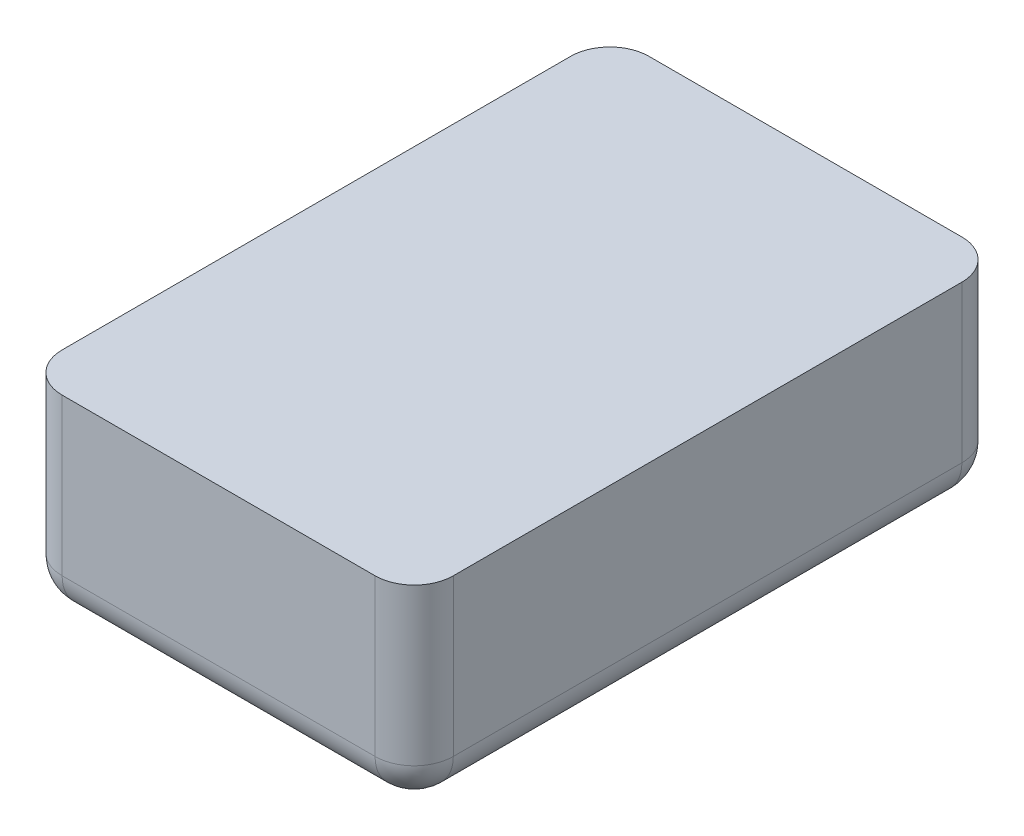
from build123d import *

# Parameters (mm, degrees)
SKETCH1_W           = 100
SKETCH1_H           = 150
BOSS_EXTRUDE1_DEPTH = 50
FILLET1_R           = 10


with BuildPart() as part:
    # Sketch1 → Boss-Extrude1 (new body)
    with BuildSketch(Plane(origin=(0, 0, 0), x_dir=(1, 0, 0), z_dir=(0, 1, 0))):
        with Locations((50, 75)):
            Rectangle(SKETCH1_W, SKETCH1_H)
    extrude(amount=BOSS_EXTRUDE1_DEPTH)

    # Fillet1
    fillet1_edges = [part.edges().sort_by_distance(p)[0] for p in [
        (50, 0, -150),
        (100, 0, -75),
        (50, 0, 0),
        (0, 0, -75),
        (0, 25, -150),
        (100, 25, -150),
        (100, 25, 0),
        (0, 25, 0),
    ]]
    fillet(fillet1_edges, radius=FILLET1_R)


solid = part.part
